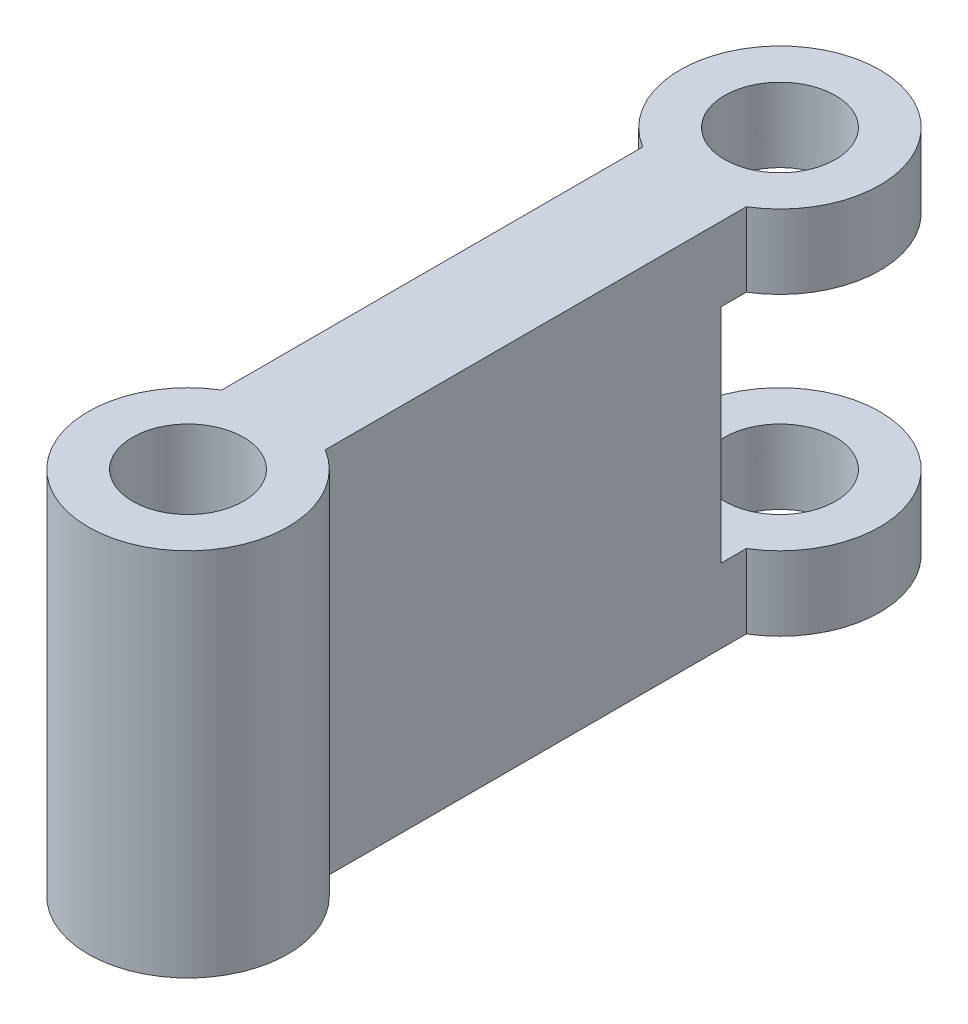
from build123d import *

# Parameters (mm, degrees)
SKETCH_1_R               = 1.5
EXTRUDE_1_DEPTH          = 10
CUT_EXTRUDE_1_DEPTH      = 3
CUT_EXTRUDE_1_DEPTH_BACK = 3
SKETCH_2_R               = 2.7


with BuildPart() as part:
    # 草图1 → 凸台-拉伸1 (new body)
    with BuildSketch(Plane(origin=(0, 0, 0), x_dir=(1, 0, 0), z_dir=(0, 1, 0))):
        with BuildLine():
            Line((-1.4, -2.308679276), (-1.4, -13.691320724))
            ThreePointArc((-1.4, -13.691320724), (0, -18.7), (1.4, -13.691320724))
            Line((1.4, -13.691320724), (1.4, -2.308679276))
            ThreePointArc((1.4, -2.308679276), (0, 2.7), (-1.4, -2.308679276))
        make_face()
        with Locations(Location((0, 0, 0), (0, 0, 270))):
            Circle(SKETCH_1_R, mode=Mode.SUBTRACT)
        with Locations(Location((0, -16, 0), (0, 0, 270))):
            Circle(SKETCH_1_R, mode=Mode.SUBTRACT)
    extrude(amount=EXTRUDE_1_DEPTH)

    # 草图2 → 切除-拉伸1 (cut, two sides: drawn at the far end of the back side and taken through both)
    with BuildSketch(Plane(origin=(0, 5, 0), x_dir=(-1, 0, 0), z_dir=(0, -1, 0)).offset(-CUT_EXTRUDE_1_DEPTH_BACK)):
        with BuildLine():
            Line((-1.4, -2.308679276), (-1.4, -3))
            Line((-1.4, -3), (1.4, -3))
            Line((1.4, -3), (1.4, -2.308679276))
            ThreePointArc((1.4, -2.308679276), (0, -2.7), (-1.4, -2.308679276))
        make_face()
        Circle(SKETCH_2_R)
    extrude(amount=CUT_EXTRUDE_1_DEPTH + CUT_EXTRUDE_1_DEPTH_BACK, mode=Mode.SUBTRACT)


solid = part.part
